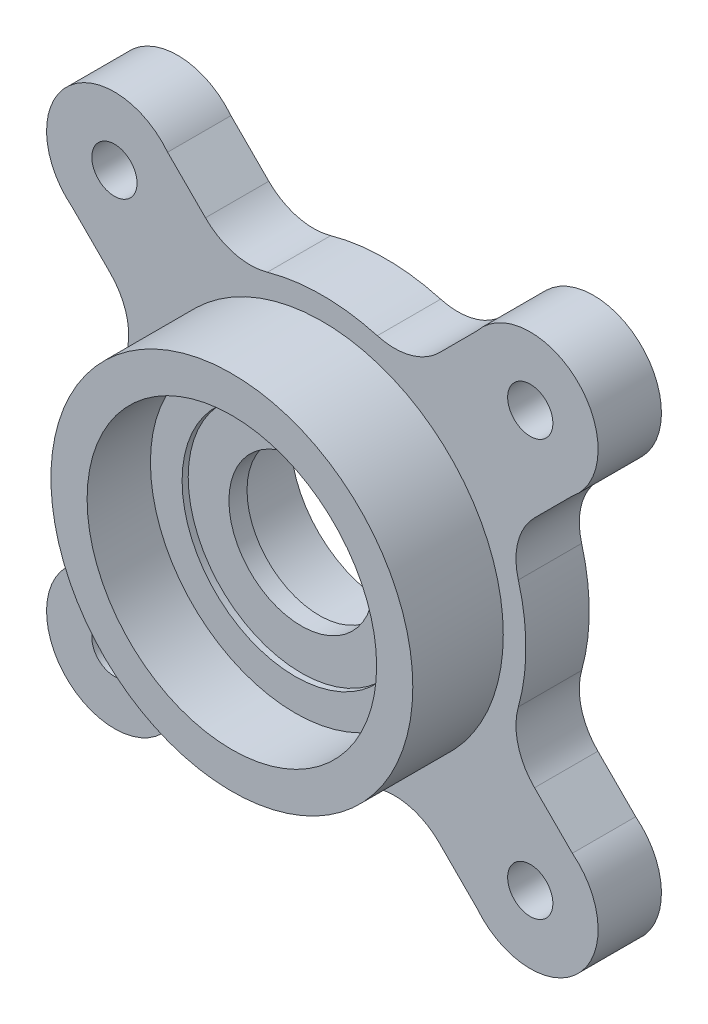
from build123d import *

# Parameters (mm, degrees)
SKETCH1_R                             = 7.5
SKETCH1_R_2                           = 22.5
F_5_IN_SHEET_DEPTH                    = 7
FILLET1_R                             = 7
F_5_0_REAMED_OVER_FOR_SHOULDER_BOLT_D = 5
SKETCH8_R                             = 20
BOSS_EXTRUDE2_DEPTH                   = 10
SKETCH2_R                             = 8
THROUGH_HOLE_DEPTH                    = 47.337664072
SKETCH7_R                             = 10.5
INBOARD_BEARING_CUP_DEPTH             = 7.325
SKETCH11_R                            = 12.5
CUT_EXTRUDE5_DEPTH                    = 7.675
SKETCH12_R                            = 16
CUT_EXTRUDE6_DEPTH                    = 7
SKETCH13_R                            = 5
CUT_EXTRUDE7_DEPTH                    = 3


with BuildPart() as part:
    # Sketch1 → .5 in sheet (new body)
    with BuildSketch(Plane.XY):
        with Locations((22.980970389, 22.980970389)):
            Circle(SKETCH1_R)
        Circle(SKETCH1_R_2)
        with Locations((-22.980970389, 22.980970389)):
            Circle(SKETCH1_R)
        with Locations((-22.980970389, -22.980970389)):
            Circle(SKETCH1_R)
        with Locations((22.980970389, -22.980970389)):
            Circle(SKETCH1_R)
        with BuildLine():
            ThreePointArc((-17.10117153, 27.636930588), (-28.284271247, 28.284271247), (-27.636930588, 17.10117153))
            Line((-27.636930588, 17.10117153), (-17.10117153, 27.636930588))
        make_face()
        with BuildLine():
            Line((-17.10117153, 27.636930588), (-27.636930588, 17.10117153))
            ThreePointArc((-27.636930588, 17.10117153), (-19.715216379, 16.229314981), (-15.480970389, 22.980970389))
            ThreePointArc((-15.480970389, 22.980970389), (-15.897592259, 25.445874906), (-17.10117153, 27.636930588))
        make_face()
        with BuildLine():
            Line((-27.636930588, 17.10117153), (-20.280355849, 9.744596791))
            ThreePointArc((-20.280355849, 9.744596791), (-15.909902577, 15.909902577), (-9.744596791, 20.280355849))
            Line((-9.744596791, 20.280355849), (-17.10117153, 27.636930588))
            ThreePointArc((-17.10117153, 27.636930588), (-15.897592259, 25.445874906), (-15.480970389, 22.980970389))
            ThreePointArc((-15.480970389, 22.980970389), (-19.715216379, 16.229314981), (-27.636930588, 17.10117153))
        make_face()
        with BuildLine():
            Line((-20.280355849, 9.744596791), (-10.535759058, 0))
            Line((-10.535759058, 0), (0, 10.535759058))
            Line((0, 10.535759058), (-9.744596791, 20.280355849))
            ThreePointArc((-9.744596791, 20.280355849), (-15.909902577, 15.909902577), (-20.280355849, 9.744596791))
        make_face()
        with BuildLine():
            Line((-9.744596791, 20.280355849), (0, 10.535759058))
            Line((0, 10.535759058), (9.744596791, 20.280355849))
            ThreePointArc((9.744596791, 20.280355849), (0, 22.5), (-9.744596791, 20.280355849))
        make_face()
        with BuildLine():
            Line((-20.280355849, -9.744596791), (-10.535759058, 0))
            Line((-10.535759058, 0), (-20.280355849, 9.744596791))
            ThreePointArc((-20.280355849, 9.744596791), (-22.5, 0), (-20.280355849, -9.744596791))
        make_face()
        with BuildLine():
            ThreePointArc((-9.744596791, -20.280355849), (0, -22.5), (9.744596791, -20.280355849))
            Line((9.744596791, -20.280355849), (0, -10.535759058))
            Line((0, -10.535759058), (-9.744596791, -20.280355849))
        make_face()
        with BuildLine():
            Line((0, -10.535759058), (9.744596791, -20.280355849))
            ThreePointArc((9.744596791, -20.280355849), (15.909902577, -15.909902577), (20.280355849, -9.744596791))
            Line((20.280355849, -9.744596791), (10.535759058, 0))
            Line((10.535759058, 0), (0, -10.535759058))
        make_face()
        with BuildLine():
            Line((10.535759058, 0), (20.280355849, -9.744596791))
            ThreePointArc((20.280355849, -9.744596791), (21.938072005, -4.997098828), (22.5, 0))
            ThreePointArc((22.5, 0), (21.938072005, 4.997098828), (20.280355849, 9.744596791))
            Line((20.280355849, 9.744596791), (10.535759058, 0))
        make_face()
        with BuildLine():
            Line((0, 10.535759058), (10.535759058, 0))
            Line((10.535759058, 0), (20.280355849, 9.744596791))
            ThreePointArc((20.280355849, 9.744596791), (15.909902577, 15.909902577), (9.744596791, 20.280355849))
            Line((9.744596791, 20.280355849), (0, 10.535759058))
        make_face()
        Polygon((-10.535759058, 0), (0, -10.535759058), (10.535759058, 0), (0, 10.535759058), align=None)
        with BuildLine():
            ThreePointArc((17.10117153, 27.636930588), (17.67766953, 17.67766953), (27.636930588, 17.10117153))
            Line((27.636930588, 17.10117153), (17.10117153, 27.636930588))
        make_face()
        with BuildLine():
            Line((17.10117153, 27.636930588), (27.636930588, 17.10117153))
            ThreePointArc((27.636930588, 17.10117153), (29.732625796, 19.715216379), (30.480970389, 22.980970389))
            ThreePointArc((30.480970389, 22.980970389), (25.445874906, 30.064348518), (17.10117153, 27.636930588))
        make_face()
        with BuildLine():
            ThreePointArc((9.744596791, 20.280355849), (15.909902577, 15.909902577), (20.280355849, 9.744596791))
            Line((20.280355849, 9.744596791), (27.636930588, 17.10117153))
            ThreePointArc((27.636930588, 17.10117153), (17.67766953, 17.67766953), (17.10117153, 27.636930588))
            Line((17.10117153, 27.636930588), (9.744596791, 20.280355849))
        make_face()
        with BuildLine():
            ThreePointArc((27.636930588, -17.10117153), (17.67766953, -17.67766953), (17.10117153, -27.636930588))
            Line((17.10117153, -27.636930588), (27.636930588, -17.10117153))
        make_face()
        with BuildLine():
            Line((27.636930588, -17.10117153), (17.10117153, -27.636930588))
            ThreePointArc((17.10117153, -27.636930588), (25.445874906, -30.064348518), (30.480970389, -22.980970389))
            ThreePointArc((30.480970389, -22.980970389), (29.732625796, -19.715216379), (27.636930588, -17.10117153))
        make_face()
        with BuildLine():
            Line((9.744596791, -20.280355849), (17.10117153, -27.636930588))
            ThreePointArc((17.10117153, -27.636930588), (17.67766953, -17.67766953), (27.636930588, -17.10117153))
            Line((27.636930588, -17.10117153), (20.280355849, -9.744596791))
            ThreePointArc((20.280355849, -9.744596791), (15.909902577, -15.909902577), (9.744596791, -20.280355849))
        make_face()
        with BuildLine():
            ThreePointArc((-27.636930588, -17.10117153), (-28.284271247, -28.284271247), (-17.10117153, -27.636930588))
            Line((-17.10117153, -27.636930588), (-27.636930588, -17.10117153))
        make_face()
        with BuildLine():
            Line((-27.636930588, -17.10117153), (-17.10117153, -27.636930588))
            ThreePointArc((-17.10117153, -27.636930588), (-15.897592259, -25.445874906), (-15.480970389, -22.980970389))
            ThreePointArc((-15.480970389, -22.980970389), (-19.715216379, -16.229314981), (-27.636930588, -17.10117153))
        make_face()
        with BuildLine():
            Line((-17.10117153, -27.636930588), (-9.744596791, -20.280355849))
            ThreePointArc((-9.744596791, -20.280355849), (-15.909902577, -15.909902577), (-20.280355849, -9.744596791))
            Line((-20.280355849, -9.744596791), (-27.636930588, -17.10117153))
            ThreePointArc((-27.636930588, -17.10117153), (-19.715216379, -16.229314981), (-15.480970389, -22.980970389))
            ThreePointArc((-15.480970389, -22.980970389), (-15.897592259, -25.445874906), (-17.10117153, -27.636930588))
        make_face()
    extrude(amount=F_5_IN_SHEET_DEPTH)

    # Fillet1
    fillet1_edges = [part.edges().sort_by_distance(p)[0] for p in [
        (-9.744596791, -20.280355849, 3.5),
        (-20.280355849, -9.744596791, 3.5),
        (-20.280355849, 9.744596791, 3.5),
        (-9.744596791, 20.280355849, 3.5),
        (9.744596791, 20.280355849, 3.5),
        (20.280355849, 9.744596791, 3.5),
        (20.280355849, -9.744596791, 3.5),
        (9.744596791, -20.280355849, 3.5),
    ]]
    fillet(fillet1_edges, radius=FILLET1_R)

    # Ø5.0 Reamed over for shoulder bolt (through all)
    with Locations(Plane(origin=(-11.055401524, 12.777106872, 7), x_dir=(1, 0, 0), z_dir=(0, 0, 1))):
        with Locations((-11.925568864, 10.203863517), (34.036371913, 10.203863517), (34.036371913, -35.758077261), (-11.925568864, -35.758077261)):
            Hole(F_5_0_REAMED_OVER_FOR_SHOULDER_BOLT_D / 2)

    # Sketch8 → Boss-Extrude2 (add)
    with BuildSketch(Plane.XY.offset(7)):
        Circle(SKETCH8_R)
    extrude(amount=BOSS_EXTRUDE2_DEPTH)

    # Sketch2 → Through hole (cut, through all)
    with BuildSketch(Plane.XY):
        Circle(SKETCH2_R)
    extrude(amount=THROUGH_HOLE_DEPTH, mode=Mode.SUBTRACT)

    # Sketch7 → Inboard bearing cup (cut)
    with BuildSketch(Plane(origin=(0, 0, 0), x_dir=(-1, 0, 0), z_dir=(0, 0, -1))):
        Circle(SKETCH7_R)
    extrude(amount=-INBOARD_BEARING_CUP_DEPTH, mode=Mode.SUBTRACT)

    # Sketch11 → Cut-Extrude5 (cut)
    with BuildSketch(Plane.XY.offset(17)):
        Circle(SKETCH11_R)
    extrude(amount=-CUT_EXTRUDE5_DEPTH, mode=Mode.SUBTRACT)

    # Sketch12 → Cut-Extrude6 (cut)
    with BuildSketch(Plane.XY.offset(17)):
        Circle(SKETCH12_R)
    extrude(amount=-CUT_EXTRUDE6_DEPTH, mode=Mode.SUBTRACT)

    # Sketch13 → Cut-Extrude7 (cut)
    with BuildSketch(Plane(origin=(0, 0, 0), x_dir=(-1, 0, 0), z_dir=(0, 0, -1))):
        with Locations((12.374368671, 12.374368671)):
            Circle(SKETCH13_R)
        with Locations((-12.374368671, 12.374368671)):
            Circle(SKETCH13_R)
        with Locations((-12.374368671, -12.374368671)):
            Circle(SKETCH13_R)
        with Locations((12.374368671, -12.374368671)):
            Circle(SKETCH13_R)
    extrude(amount=-CUT_EXTRUDE7_DEPTH, mode=Mode.SUBTRACT)


solid = part.part
